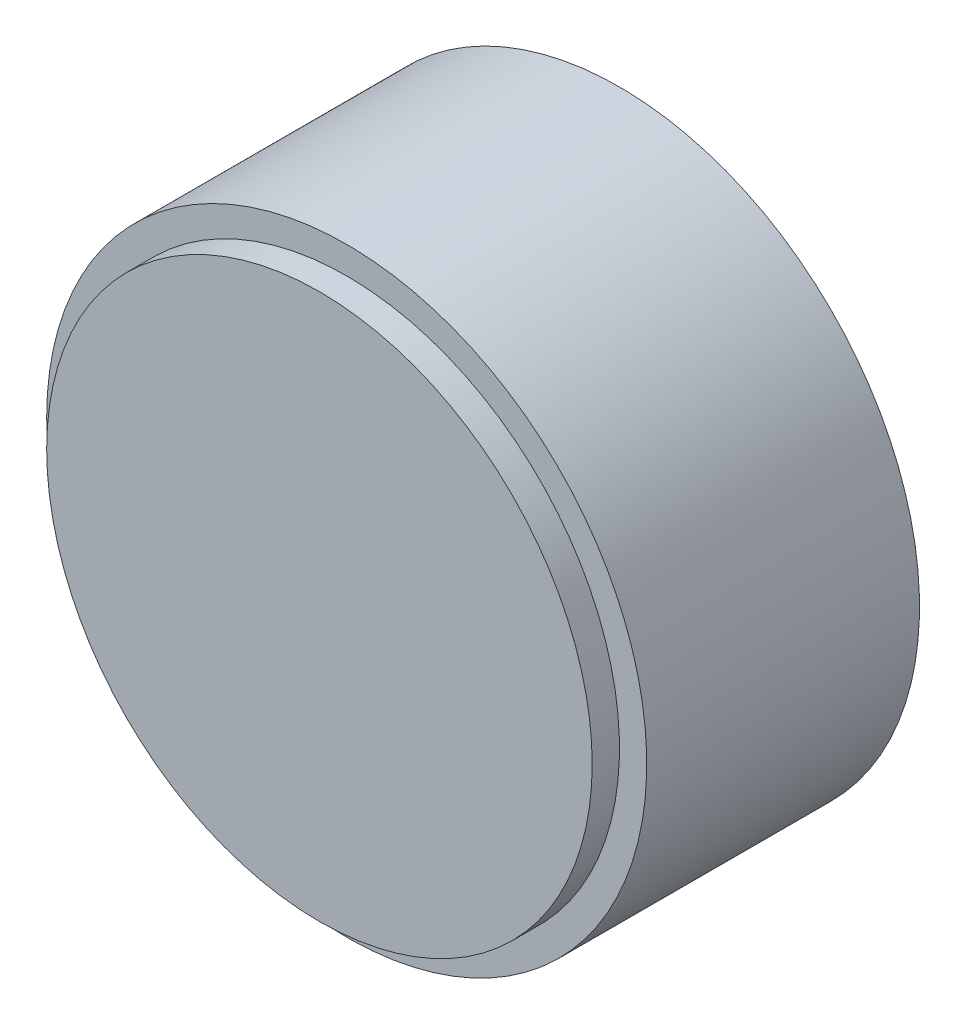
from build123d import *

# Parameters (mm, degrees)
ESQUISSE1_R             = 30
BOSS_EXTRU_1_DEPTH      = 35
ESQUISSE2_R             = 2
ENL_V_MAT_EXTRU_1_DEPTH = 10
BOSS_EXTRU_2_START      = -2
ESQUISSE3_R             = 33
ESQUISSE3_R_2           = 30
BOSS_EXTRU_2_DEPTH      = 30


with BuildPart() as part:
    # Esquisse1 → Boss.-Extru.1 (new body)
    with BuildSketch(Plane.XY):
        Circle(ESQUISSE1_R)
    extrude(amount=BOSS_EXTRU_1_DEPTH)

    # Esquisse2 → Enlèv. mat.-Extru.1 (cut)
    with BuildSketch(Plane(origin=(0, 0, 0), x_dir=(-1, 0, 0), z_dir=(0, 0, -1))):
        with Locations((0, 8)):
            Circle(ESQUISSE2_R)
        with Locations((8, 0)):
            Circle(ESQUISSE2_R)
        with Locations((0, -8)):
            Circle(ESQUISSE2_R)
        with Locations((-8, 0)):
            Circle(ESQUISSE2_R)
        Circle(ESQUISSE2_R)
    extrude(amount=-ENL_V_MAT_EXTRU_1_DEPTH, mode=Mode.SUBTRACT)

    # Esquisse3 → Boss.-Extru.2 (add)
    with BuildSketch(Plane(origin=(0, 0, 0), x_dir=(-1, 0, 0), z_dir=(0, 0, -1)).offset(BOSS_EXTRU_2_START)):
        Circle(ESQUISSE3_R)
        Circle(ESQUISSE3_R_2, mode=Mode.SUBTRACT)
    extrude(amount=-BOSS_EXTRU_2_DEPTH)


solid = part.part
